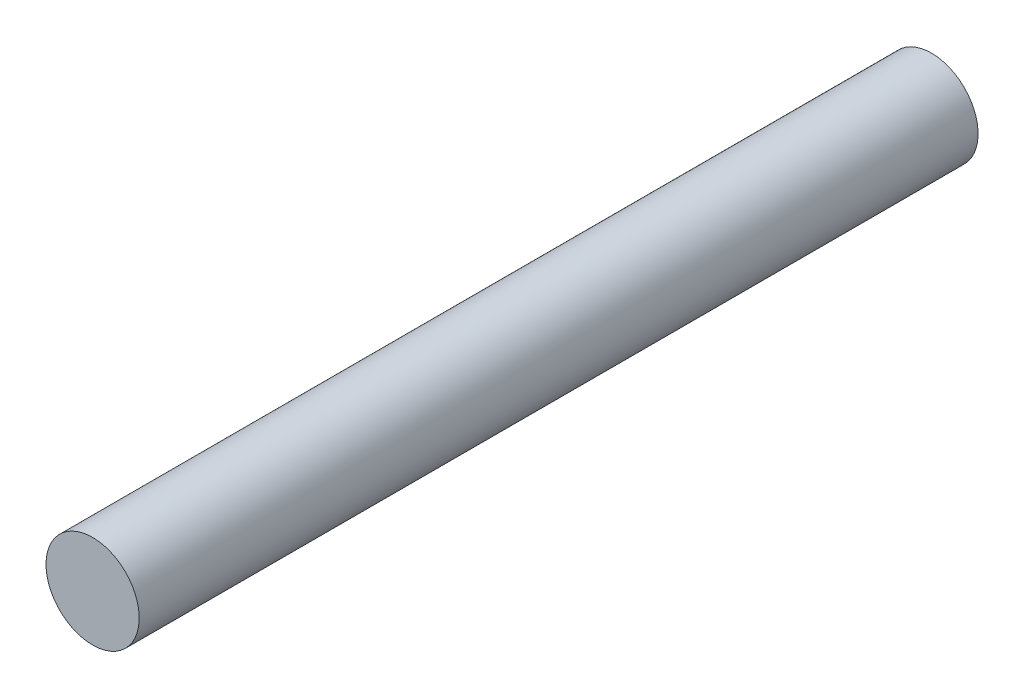
from build123d import *

# Parameters (mm, degrees)
SKETCH_1_R      = 5
EXTRUDE_1_DEPTH = 90


with BuildPart() as part:
    # 草图1 → 凸台-拉伸1 (new body)
    with BuildSketch(Plane.XY):
        with Locations(Location((0, 0, 0), (0, 0, 180))):
            Circle(SKETCH_1_R)
    extrude(amount=EXTRUDE_1_DEPTH)


solid = part.part
